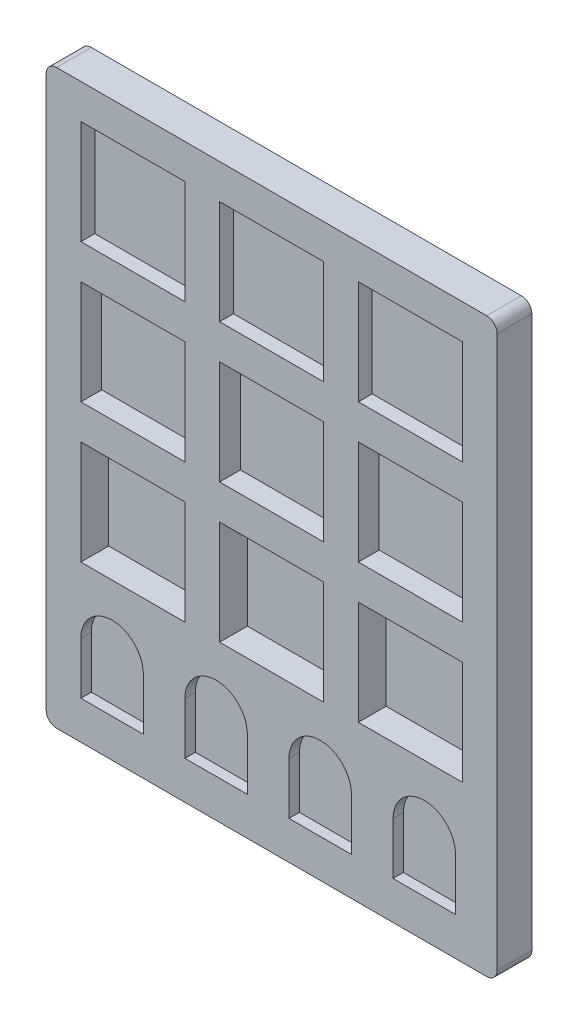
from build123d import *

# Parameters (mm, degrees)
EXTRUDE_1_DEPTH     = 10
SKETCH_6_W          = 30
SKETCH_6_H          = 30
CUT_EXTRUDE_1_DEPTH = 4
SKETCH_7_W          = 30
SKETCH_7_H          = 30
CUT_EXTRUDE_2_DEPTH = 6
SKETCH_8_W          = 30
SKETCH_8_H          = 30
CUT_EXTRUDE_3_DEPTH = 8
CUT_EXTRUDE_4_DEPTH = 3


with BuildPart() as part:
    # 草图1 → 凸台-拉伸1 (new body)
    with BuildSketch(Plane.XY):
        with BuildLine():
            Line((62, -82.5), (-62, -82.5))
            ThreePointArc((-62, -82.5), (-64.121320344, -81.621320344), (-65, -79.5))
            Line((-65, -79.5), (-65, 79.5))
            ThreePointArc((-65, 79.5), (-64.121320344, 81.621320344), (-62, 82.5))
            Line((-62, 82.5), (62, 82.5))
            ThreePointArc((62, 82.5), (64.121320344, 81.621320344), (65, 79.5))
            Line((65, 79.5), (65, -79.5))
            ThreePointArc((65, -79.5), (64.121320344, -81.621320344), (62, -82.5))
        make_face()
    extrude(amount=EXTRUDE_1_DEPTH)

    # 草图6 → 切除-拉伸1 (cut)
    with BuildSketch(Plane.XY.offset(10)):
        with Locations((-40, 57.5)):
            Rectangle(SKETCH_6_W, SKETCH_6_H)
        with Locations((0, 57.5)):
            Rectangle(SKETCH_6_W, SKETCH_6_H)
        with Locations((40, 57.5)):
            Rectangle(SKETCH_6_W, SKETCH_6_H)
    extrude(amount=-CUT_EXTRUDE_1_DEPTH, mode=Mode.SUBTRACT)

    # 草图7 → 切除-拉伸2 (cut)
    with BuildSketch(Plane.XY.offset(10)):
        with Locations((-40, 17.5)):
            Rectangle(SKETCH_7_W, SKETCH_7_H)
        with Locations((0, 17.5)):
            Rectangle(SKETCH_7_W, SKETCH_7_H)
        with Locations((40, 17.5)):
            Rectangle(SKETCH_7_W, SKETCH_7_H)
    extrude(amount=-CUT_EXTRUDE_2_DEPTH, mode=Mode.SUBTRACT)

    # 草图8 → 切除-拉伸3 (cut)
    with BuildSketch(Plane.XY.offset(10)):
        with Locations((-40, -22.5)):
            Rectangle(SKETCH_8_W, SKETCH_8_H)
        with Locations((0, -22.5)):
            Rectangle(SKETCH_8_W, SKETCH_8_H)
        with Locations((40, -22.5)):
            Rectangle(SKETCH_8_W, SKETCH_8_H)
    extrude(amount=-CUT_EXTRUDE_3_DEPTH, mode=Mode.SUBTRACT)

    # 草图9 → 切除-拉伸4 (cut)
    with BuildSketch(Plane.XY.offset(10)):
        with BuildLine():
            Line((-55, -71.5), (-37, -71.5))
            Line((-37, -71.5), (-37, -56.5))
            ThreePointArc((-37, -56.5), (-46, -47.5), (-55, -56.5))
            Line((-55, -56.5), (-55, -71.5))
        make_face()
        with BuildLine():
            Line((-25, -56.5), (-25, -71.5))
            Line((-25, -71.5), (-7, -71.5))
            Line((-7, -71.5), (-7, -56.5))
            ThreePointArc((-7, -56.5), (-16, -47.5), (-25, -56.5))
        make_face()
        with BuildLine():
            Line((5, -56.5), (5, -71.5))
            Line((5, -71.5), (23, -71.5))
            Line((23, -71.5), (23, -56.5))
            ThreePointArc((23, -56.5), (14, -47.5), (5, -56.5))
        make_face()
        with BuildLine():
            Line((35, -56.5), (35, -71.5))
            Line((35, -71.5), (53, -71.5))
            Line((53, -71.5), (53, -56.5))
            ThreePointArc((53, -56.5), (44, -47.5), (35, -56.5))
        make_face()
    extrude(amount=-CUT_EXTRUDE_4_DEPTH, mode=Mode.SUBTRACT)


solid = part.part
